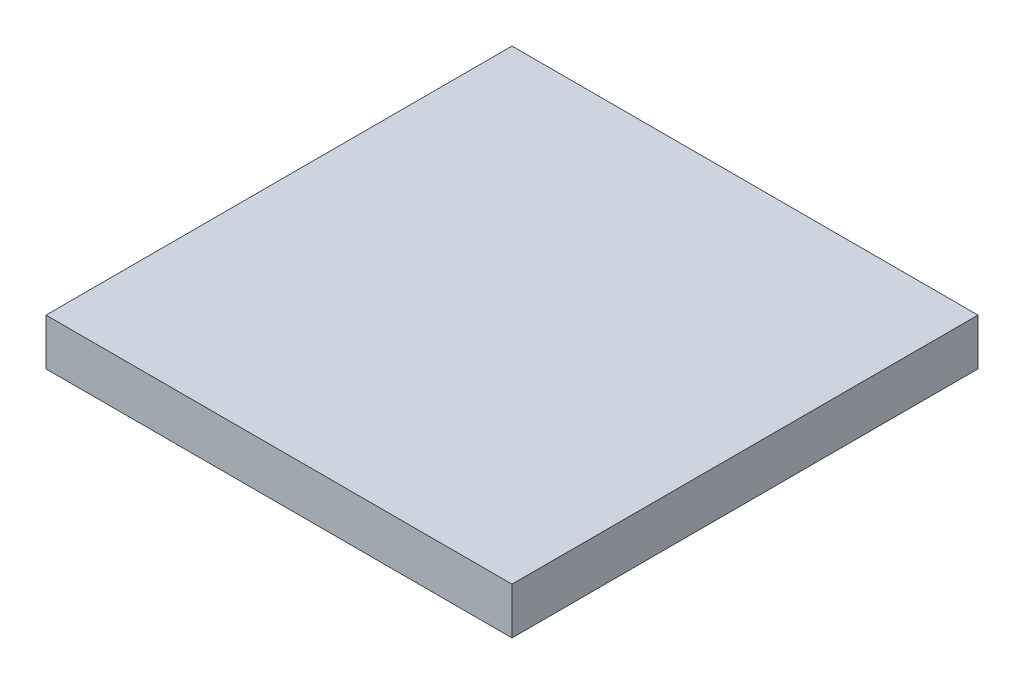
from build123d import *

# Parameters (mm, degrees)
CROQUIS1_W              = 100
CROQUIS1_H              = 100
SALIENTE_EXTRUIR1_DEPTH = 10


with BuildPart() as part:
    # Croquis1 → Saliente-Extruir1 (new body)
    with BuildSketch(Plane(origin=(0, 0, 0), x_dir=(1, 0, 0), z_dir=(0, 1, 0))):
        with Locations((50, 50)):
            Rectangle(CROQUIS1_W, CROQUIS1_H)
    extrude(amount=SALIENTE_EXTRUIR1_DEPTH)


solid = part.part
